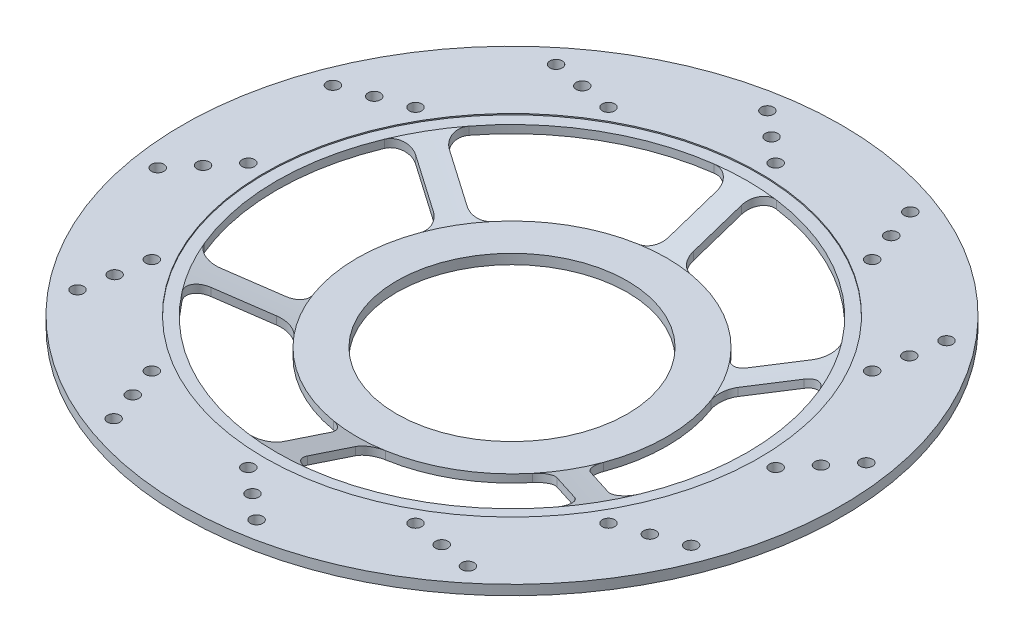
from build123d import *

# Parameters (mm, degrees)
SKETCH3_R           = 4
CUT_EXTRUDE1_DEPTH  = 284.71260106
BOSS_EXTRUDE1_START = 0.7
SKETCH4_R           = 200
SKETCH4_R_2         = 150
BOSS_EXTRUDE1_DEPTH = 0.7
BOSS_EXTRUDE2_START = -4.6
SKETCH4_2_R         = 200
SKETCH4_2_R_2       = 150
BOSS_EXTRUDE2_DEPTH = 0.7
SKETCH5_R           = 3.75
CUT_EXTRUDE3_DEPTH  = 6


with BuildPart() as part:
    # Sketch1 → Revolve2 (revolve)
    with BuildSketch(Plane.XY, mode=Mode.PRIVATE) as revolve2_sk:
        Polygon((70, 0), (90.526290049, 0), (143.543574, 17.6), (200, 17.6), (200, 22.2), (142.8, 22.2), (94, 6), (70, 6), align=None)
    revolve(revolve2_sk.sketch.rotate(Axis((0, 0, 0), (0, 1, 0)), 90), axis=Axis((0, 0, 0), (0, 1, 0)))

    # Sketch3 → Cut-Extrude1 (cut, through all)
    with BuildSketch(Plane(origin=(0, 22.2, 0), x_dir=(1, 0, 0), z_dir=(0, 1, 0))):
        with Locations((0, 39)):
            Circle(SKETCH3_R)
        with Locations((33.774990748, 19.5)):
            Circle(SKETCH3_R)
        with Locations((33.774990748, -19.5)):
            Circle(SKETCH3_R)
        with Locations((0, -39)):
            Circle(SKETCH3_R)
        with Locations((-33.774990748, -19.5)):
            Circle(SKETCH3_R)
        with Locations((-33.774990748, 19.5)):
            Circle(SKETCH3_R)
        with BuildLine():
            Line((7.5, 102.517071749), (7.5, 131.641900624))
            ThreePointArc((7.5, 131.641900624), (10.911286576, 139.164457066), (18.817771084, 141.554694346))
            ThreePointArc((18.817771084, 141.554694346), (71.4, 123.66842766), (113.181075786, 87.074014975))
            ThreePointArc((113.181075786, 87.074014975), (115.064311835, 79.031679896), (110.255230143, 72.316140841))
            Line((110.255230143, 72.316140841), (85.032388456, 57.753726403))
            ThreePointArc((85.032388456, 57.753726403), (78.269031253, 56.570679603), (72.336966489, 60.028020783))
            ThreePointArc((72.336966489, 60.028020783), (47, 81.406387956), (15.817307692, 92.659661004))
            ThreePointArc((15.817307692, 92.659661004), (9.85713002, 96.068309196), (7.5, 102.517071749))
        make_face()
        with BuildLine():
            Line((92.532388456, 44.763345346), (117.755230143, 59.325759784))
            ThreePointArc((117.755230143, 59.325759784), (125.975598411, 60.13277717), (131.998846871, 54.480679371))
            ThreePointArc((131.998846871, 54.480679371), (142.8, 0), (131.998846871, -54.480679371))
            ThreePointArc((131.998846871, -54.480679371), (125.975598411, -60.13277717), (117.755230143, -59.325759784))
            Line((117.755230143, -59.325759784), (92.532388456, -44.763345346))
            ThreePointArc((92.532388456, -44.763345346), (88.126161272, -39.497629593), (88.154274182, -32.631640221))
            ThreePointArc((88.154274182, -32.631640221), (94, 0), (88.154274182, 32.631640221))
            ThreePointArc((88.154274182, 32.631640221), (88.126161272, 39.497629593), (92.532388456, 44.763345346))
        make_face()
        with BuildLine():
            Line((85.032388456, -57.753726403), (110.255230143, -72.316140841))
            ThreePointArc((110.255230143, -72.316140841), (115.064311835, -79.031679896), (113.181075786, -87.074014975))
            ThreePointArc((113.181075786, -87.074014975), (71.4, -123.66842766), (18.817771084, -141.554694346))
            ThreePointArc((18.817771084, -141.554694346), (10.911286576, -139.164457066), (7.5, -131.641900624))
            Line((7.5, -131.641900624), (7.5, -102.517071749))
            ThreePointArc((7.5, -102.517071749), (9.85713002, -96.068309196), (15.817307692, -92.659661004))
            ThreePointArc((15.817307692, -92.659661004), (47, -81.406387956), (72.336966489, -60.028020783))
            ThreePointArc((72.336966489, -60.028020783), (78.269031253, -56.570679603), (85.032388456, -57.753726403))
        make_face()
        with BuildLine():
            Line((-7.5, -102.517071749), (-7.5, -131.641900624))
            ThreePointArc((-7.5, -131.641900624), (-10.911286576, -139.164457066), (-18.817771084, -141.554694346))
            ThreePointArc((-18.817771084, -141.554694346), (-71.4, -123.66842766), (-113.181075786, -87.074014975))
            ThreePointArc((-113.181075786, -87.074014975), (-115.064311835, -79.031679896), (-110.255230143, -72.316140841))
            Line((-110.255230143, -72.316140841), (-85.032388456, -57.753726403))
            ThreePointArc((-85.032388456, -57.753726403), (-78.269031253, -56.570679603), (-72.336966489, -60.028020783))
            ThreePointArc((-72.336966489, -60.028020783), (-47, -81.406387956), (-15.817307692, -92.659661004))
            ThreePointArc((-15.817307692, -92.659661004), (-9.85713002, -96.068309196), (-7.5, -102.517071749))
        make_face()
        with BuildLine():
            Line((-92.532388456, -44.763345346), (-117.755230143, -59.325759784))
            ThreePointArc((-117.755230143, -59.325759784), (-125.975598411, -60.13277717), (-131.998846871, -54.480679371))
            ThreePointArc((-131.998846871, -54.480679371), (-142.8, 0), (-131.998846871, 54.480679371))
            ThreePointArc((-131.998846871, 54.480679371), (-125.975598411, 60.13277717), (-117.755230143, 59.325759784))
            Line((-117.755230143, 59.325759784), (-92.532388456, 44.763345346))
            ThreePointArc((-92.532388456, 44.763345346), (-88.126161272, 39.497629593), (-88.154274182, 32.631640221))
            ThreePointArc((-88.154274182, 32.631640221), (-94, 0), (-88.154274182, -32.631640221))
            ThreePointArc((-88.154274182, -32.631640221), (-88.126161272, -39.497629593), (-92.532388456, -44.763345346))
        make_face()
        with BuildLine():
            Line((-85.032388456, 57.753726403), (-110.255230143, 72.316140841))
            ThreePointArc((-110.255230143, 72.316140841), (-115.064311835, 79.031679896), (-113.181075786, 87.074014975))
            ThreePointArc((-113.181075786, 87.074014975), (-71.4, 123.66842766), (-18.817771084, 141.554694346))
            ThreePointArc((-18.817771084, 141.554694346), (-10.911286576, 139.164457066), (-7.5, 131.641900624))
            Line((-7.5, 131.641900624), (-7.5, 102.517071749))
            ThreePointArc((-7.5, 102.517071749), (-9.85713002, 96.068309196), (-15.817307692, 92.659661004))
            ThreePointArc((-15.817307692, 92.659661004), (-47, 81.406387956), (-72.336966489, 60.028020783))
            ThreePointArc((-72.336966489, 60.028020783), (-78.269031253, 56.570679603), (-85.032388456, 57.753726403))
        make_face()
    extrude(amount=-CUT_EXTRUDE1_DEPTH, mode=Mode.SUBTRACT)

    # Sketch4 → Boss-Extrude1 (add)
    with BuildSketch(Plane(origin=(0, 22.2, 0), x_dir=(1, 0, 0), z_dir=(0, 1, 0)).offset(BOSS_EXTRUDE1_START)):
        with Locations(Location((0, 0, 0), (0, 0, 90))):
            Circle(SKETCH4_R)
        with Locations(Location((0, 0, 0), (0, 0, 270))):
            Circle(SKETCH4_R_2, mode=Mode.SUBTRACT)
    extrude(amount=-BOSS_EXTRUDE1_DEPTH)

    # Sketch4<2> → Boss-Extrude2 (add)
    with BuildSketch(Plane(origin=(0, 22.2, 0), x_dir=(1, 0, 0), z_dir=(0, 1, 0)).offset(BOSS_EXTRUDE2_START)):
        with Locations(Location((0, 0, 0), (0, 0, 90))):
            Circle(SKETCH4_2_R)
        with Locations(Location((0, 0, 0), (0, 0, 270))):
            Circle(SKETCH4_2_R_2, mode=Mode.SUBTRACT)
    extrude(amount=-BOSS_EXTRUDE2_DEPTH)

    # Sketch5 → Cut-Extrude3 (cut)
    with BuildSketch(Plane(origin=(0, 22.9, 0), x_dir=(1, 0, 0), z_dir=(0, 1, 0))):
        with Locations(Location((-30, 185, 0), (0, 0, 270))):
            Circle(SKETCH5_R)
        with Locations(Location((-15, 172.5, 0), (0, 0, 270))):
            Circle(SKETCH5_R)
        with Locations(Location((0, 160, 0), (0, 0, 270))):
            Circle(SKETCH5_R)
        with Locations(Location((80, 138.564064606, 0), (0, 0, 270))):
            Circle(SKETCH5_R)
        with Locations(Location((73.259618943, 156.889382153, 0), (0, 0, 270))):
            Circle(SKETCH5_R)
        with Locations(Location((66.519237886, 175.2146997, 0), (0, 0, 270))):
            Circle(SKETCH5_R)
        with Locations(Location((138.564064606, 80, 0), (0, 0, 270))):
            Circle(SKETCH5_R)
        with Locations(Location((141.889382153, 99.240381057, 0), (0, 0, 270))):
            Circle(SKETCH5_R)
        with Locations(Location((145.2146997, 118.480762114, 0), (0, 0, 270))):
            Circle(SKETCH5_R)
        with Locations(Location((160, 0, 0), (0, 0, 270))):
            Circle(SKETCH5_R)
        with Locations(Location((172.5, 15, 0), (0, 0, 270))):
            Circle(SKETCH5_R)
        with Locations(Location((185, 30, 0), (0, 0, 270))):
            Circle(SKETCH5_R)
        with Locations(Location((138.564064606, -80, 0), (0, 0, 270))):
            Circle(SKETCH5_R)
        with Locations(Location((156.889382153, -73.259618943, 0), (0, 0, 270))):
            Circle(SKETCH5_R)
        with Locations(Location((175.2146997, -66.519237886, 0), (0, 0, 270))):
            Circle(SKETCH5_R)
        with Locations(Location((80, -138.564064605, 0), (0, 0, 270))):
            Circle(SKETCH5_R)
        with Locations(Location((99.240381057, -141.889382153, 0), (0, 0, 270))):
            Circle(SKETCH5_R)
        with Locations(Location((118.480762114, -145.2146997, 0), (0, 0, 270))):
            Circle(SKETCH5_R)
        with Locations(Location((0, -160, 0), (0, 0, 270))):
            Circle(SKETCH5_R)
        with Locations(Location((15, -172.5, 0), (0, 0, 270))):
            Circle(SKETCH5_R)
        with Locations(Location((30, -185, 0), (0, 0, 270))):
            Circle(SKETCH5_R)
        with Locations(Location((-80, -138.564064606, 0), (0, 0, 270))):
            Circle(SKETCH5_R)
        with Locations(Location((-73.259618943, -156.889382153, 0), (0, 0, 270))):
            Circle(SKETCH5_R)
        with Locations(Location((-66.519237886, -175.2146997, 0), (0, 0, 270))):
            Circle(SKETCH5_R)
        with Locations(Location((-138.564064605, -80, 0), (0, 0, 270))):
            Circle(SKETCH5_R)
        with Locations(Location((-141.889382153, -99.240381057, 0), (0, 0, 270))):
            Circle(SKETCH5_R)
        with Locations(Location((-145.2146997, -118.480762114, 0), (0, 0, 270))):
            Circle(SKETCH5_R)
        with Locations(Location((-160, 0, 0), (0, 0, 270))):
            Circle(SKETCH5_R)
        with Locations(Location((-172.5, -15, 0), (0, 0, 270))):
            Circle(SKETCH5_R)
        with Locations(Location((-185, -30, 0), (0, 0, 270))):
            Circle(SKETCH5_R)
        with Locations(Location((-138.564064605, 80, 0), (0, 0, 270))):
            Circle(SKETCH5_R)
        with Locations(Location((-156.889382153, 73.259618943, 0), (0, 0, 270))):
            Circle(SKETCH5_R)
        with Locations(Location((-175.2146997, 66.519237886, 0), (0, 0, 270))):
            Circle(SKETCH5_R)
        with Locations(Location((-80, 138.564064605, 0), (0, 0, 270))):
            Circle(SKETCH5_R)
        with Locations(Location((-99.240381057, 141.889382153, 0), (0, 0, 270))):
            Circle(SKETCH5_R)
        with Locations(Location((-118.480762114, 145.2146997, 0), (0, 0, 270))):
            Circle(SKETCH5_R)
    extrude(amount=-CUT_EXTRUDE3_DEPTH, mode=Mode.SUBTRACT)


solid = part.part
